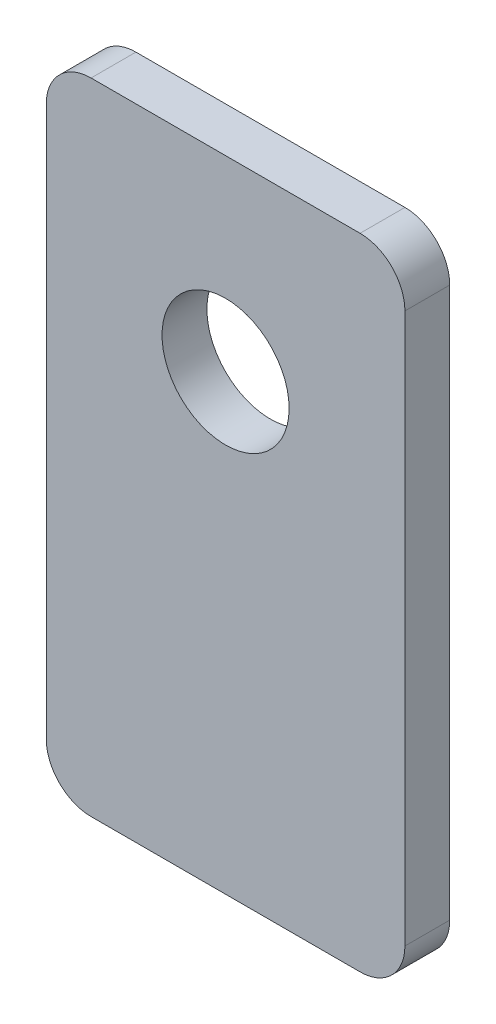
from build123d import *

# Parameters (mm, degrees)
SKETCH1_W           = 25.4
SKETCH1_H           = 45.3
BOSS_EXTRUDE1_DEPTH = 3.175
SKETCH2_R           = 4.5
CUT_EXTRUDE1_DEPTH  = 27.160908337
FILLET1_R           = 3.175


with BuildPart() as part:
    # Sketch1 → Boss-Extrude1 (new body)
    with BuildSketch(Plane.XY):
        Rectangle(SKETCH1_W, SKETCH1_H)
    extrude(amount=BOSS_EXTRUDE1_DEPTH)

    # Sketch2 → Cut-Extrude1 (cut, through all)
    with BuildSketch(Plane.XY.offset(3.175)):
        with Locations((0, 9.4)):
            Circle(SKETCH2_R)
    extrude(amount=-CUT_EXTRUDE1_DEPTH, mode=Mode.SUBTRACT)

    # Fillet1
    fillet1_edges = [part.edges().sort_by_distance(p)[0] for p in [
        (12.7, -22.65, 1.5875),
        (-12.7, -22.65, 1.5875),
        (-12.7, 22.65, 1.5875),
        (12.7, 22.65, 1.5875),
    ]]
    fillet(fillet1_edges, radius=FILLET1_R)


solid = part.part
